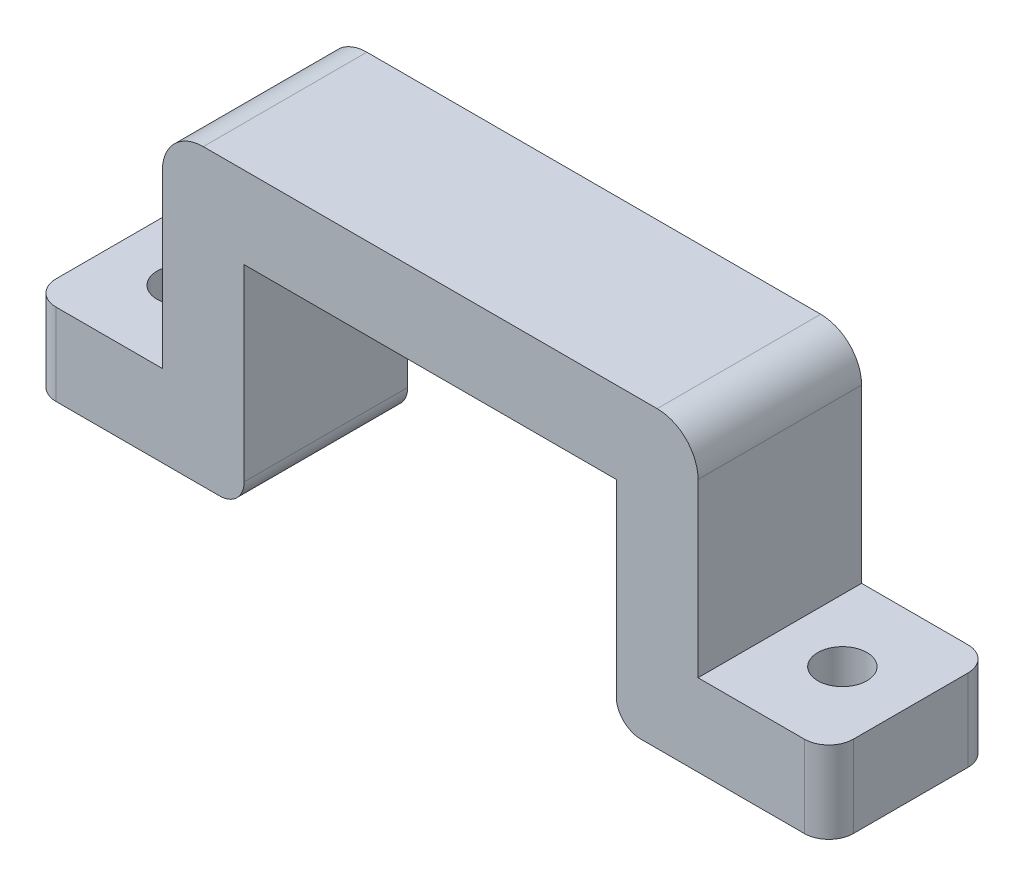
from build123d import *

# Parameters (mm, degrees)
BOSS_EXTRU_1_DEPTH      = 10
ESQUISSE2_W             = 10
ESQUISSE2_H             = 5
BOSS_EXTRU_2_DEPTH      = 8
ESQUISSE3_W             = 10
ESQUISSE3_H             = 5
BOSS_EXTRU_3_DEPTH      = 8
CONG_1_R                = 1.5
CONG_2_R                = 1.5
ESQUISSE4_R             = 1.5
ENL_V_MAT_EXTRU_1_DEPTH = 30.379255011


with BuildPart() as part:
    # Esquisse1 → Boss.-Extru.1 (new body)
    with BuildSketch(Plane.XY):
        with BuildLine():
            ThreePointArc((-16.375, 9), (-15.642766953, 10.767766953), (-13.875, 11.5))
            Line((-13.875, 11.5), (13.875, 11.5))
            ThreePointArc((13.875, 11.5), (15.642766953, 10.767766953), (16.375, 9))
            Line((16.375, 9), (16.375, -6.5))
            Line((16.375, -6.5), (11.375, -6.5))
            Line((11.375, -6.5), (11.375, 6.5))
            Line((11.375, 6.5), (-11.375, 6.5))
            Line((-11.375, 6.5), (-11.375, -6.5))
            Line((-11.375, -6.5), (-16.375, -6.5))
            Line((-16.375, -6.5), (-16.375, 9))
        make_face()
    extrude(amount=BOSS_EXTRU_1_DEPTH)

    # Esquisse2 → Boss.-Extru.2 (add)
    with BuildSketch(Plane.ZY.offset(16.375)):
        with Locations((5, -4)):
            Rectangle(ESQUISSE2_W, ESQUISSE2_H)
    extrude(amount=BOSS_EXTRU_2_DEPTH)

    # Esquisse3 → Boss.-Extru.3 (add)
    with BuildSketch(Plane(origin=(16.375, 0, 0), x_dir=(0, 0, -1), z_dir=(1, 0, 0))):
        with Locations((-5, -4)):
            Rectangle(ESQUISSE3_W, ESQUISSE3_H)
    extrude(amount=BOSS_EXTRU_3_DEPTH)

    # Congé1
    cong_1_edges = [part.edges().sort_by_distance(p)[0] for p in [
        (-24.375, -4, 0),
        (-24.375, -4, 10),
        (24.375, -4, 10),
        (24.375, -4, 0),
    ]]
    fillet(cong_1_edges, radius=CONG_1_R)

    # Congé2
    cong_2_edges = [part.edges().sort_by_distance(p)[0] for p in [
        (11.375, -6.5, 5),
        (-11.375, -6.5, 5),
    ]]
    fillet(cong_2_edges, radius=CONG_2_R)

    # Esquisse4 → Enlèv. mat.-Extru.1 (cut, through all)
    with BuildSketch(Plane(origin=(0, -1.5, 0), x_dir=(1, 0, 0), z_dir=(0, 1, 0))):
        with Locations(Location((-20.198529412, -5, 0), (0, 0, 180))):
            Circle(ESQUISSE4_R)
        with Locations(Location((20.198529412, -5, 0), (0, 0, 180))):
            Circle(ESQUISSE4_R)
    extrude(amount=-ENL_V_MAT_EXTRU_1_DEPTH, mode=Mode.SUBTRACT)


solid = part.part
